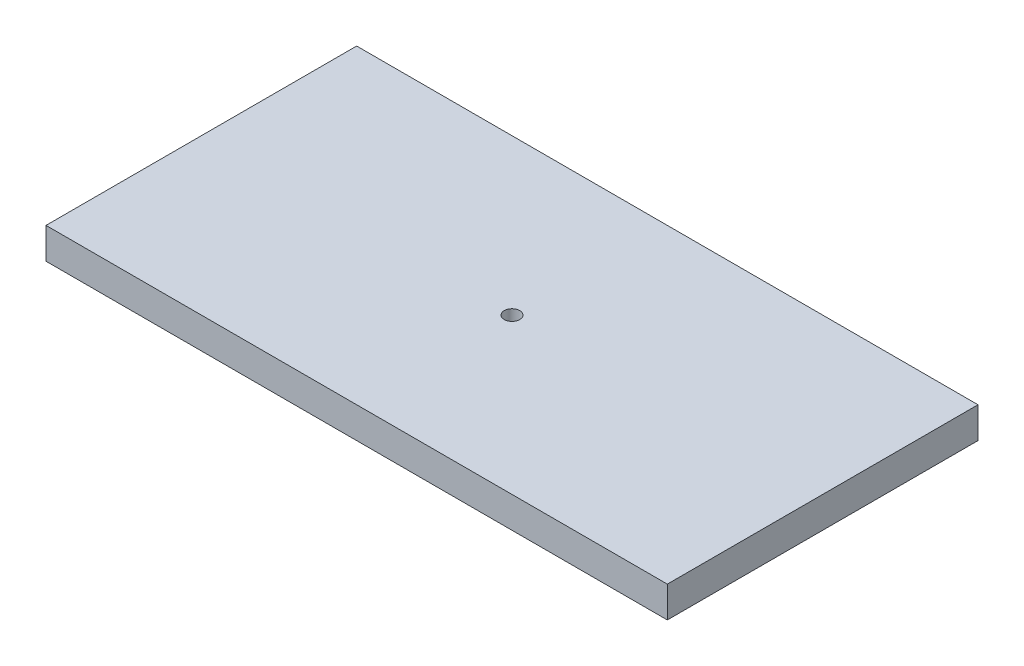
from build123d import *

# Parameters (mm, degrees)
SKETCH1_W           = 200
SKETCH1_H           = 100
BOSS_EXTRUDE1_DEPTH = 10
SKETCH2_R           = 2.5
CUT_EXTRUDE1_DEPTH  = 5


with BuildPart() as part:
    # Sketch1 → Boss-Extrude1 (new body)
    with BuildSketch(Plane(origin=(0, 0, 0), x_dir=(1, 0, 0), z_dir=(0, 1, 0))):
        with Locations((100, 50)):
            Rectangle(SKETCH1_W, SKETCH1_H)
    extrude(amount=BOSS_EXTRUDE1_DEPTH)

    # Sketch2 → Cut-Extrude1 (cut)
    with BuildSketch(Plane(origin=(0, 10, 0), x_dir=(1, 0, 0), z_dir=(0, 1, 0))):
        with Locations(Location((100, 50, 0), (0, 0, 270))):
            Circle(SKETCH2_R)
    extrude(amount=-CUT_EXTRUDE1_DEPTH, mode=Mode.SUBTRACT)


solid = part.part
